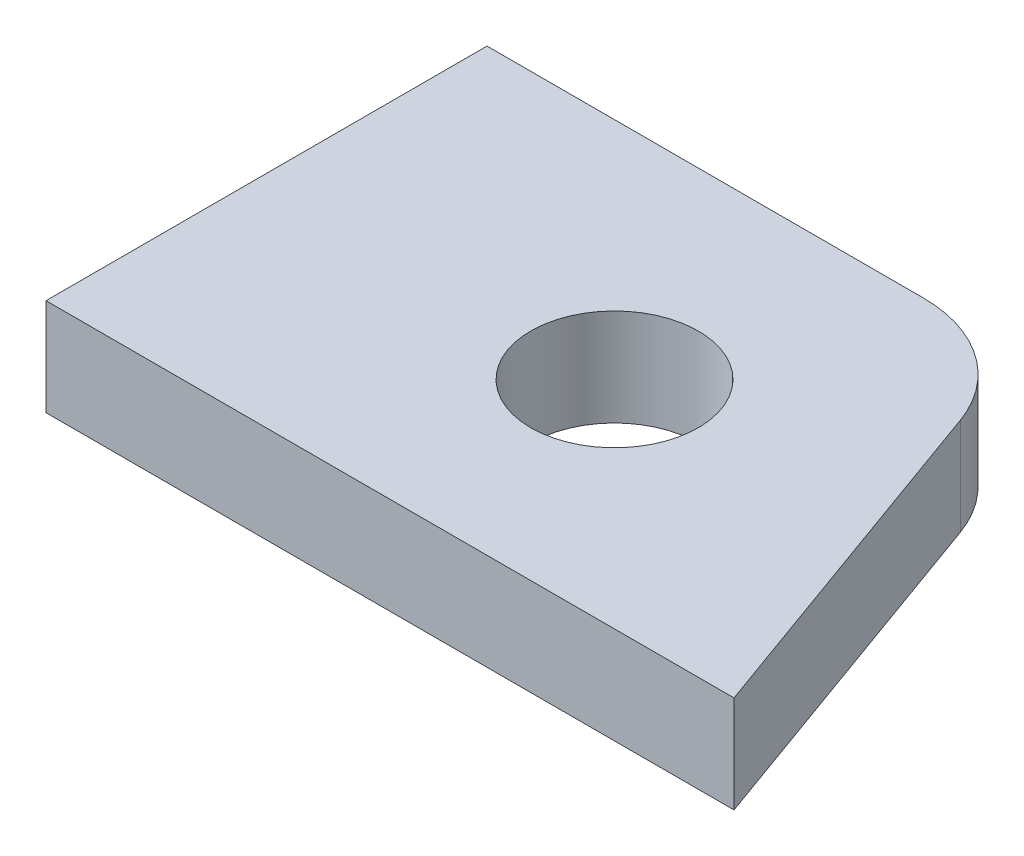
from build123d import *

# Parameters (mm, degrees)
SKETCH1_R           = 9.5
BOSS_EXTRUDE1_DEPTH = 11


with BuildPart() as part:
    # Sketch1 → Boss-Extrude1 (new body)
    with BuildSketch(Plane(origin=(0, 0, 0), x_dir=(1, 0, 0), z_dir=(0, 1, 0))):
        with BuildLine():
            Line((0, 0), (78, 0))
            Line((78, 0), (63.570914871, 40.080792024))
            ThreePointArc((63.570914871, 40.080792024), (58.082802811, 47.272161186), (49.457603693, 50))
            Line((49.457603693, 50), (0, 50))
            Line((0, 50), (0, 0))
        make_face()
        with Locations(Location((39.952273438, 24.5, 0), (0, 0, 270))):
            Circle(SKETCH1_R, mode=Mode.SUBTRACT)
    extrude(amount=BOSS_EXTRUDE1_DEPTH)


solid = part.part
